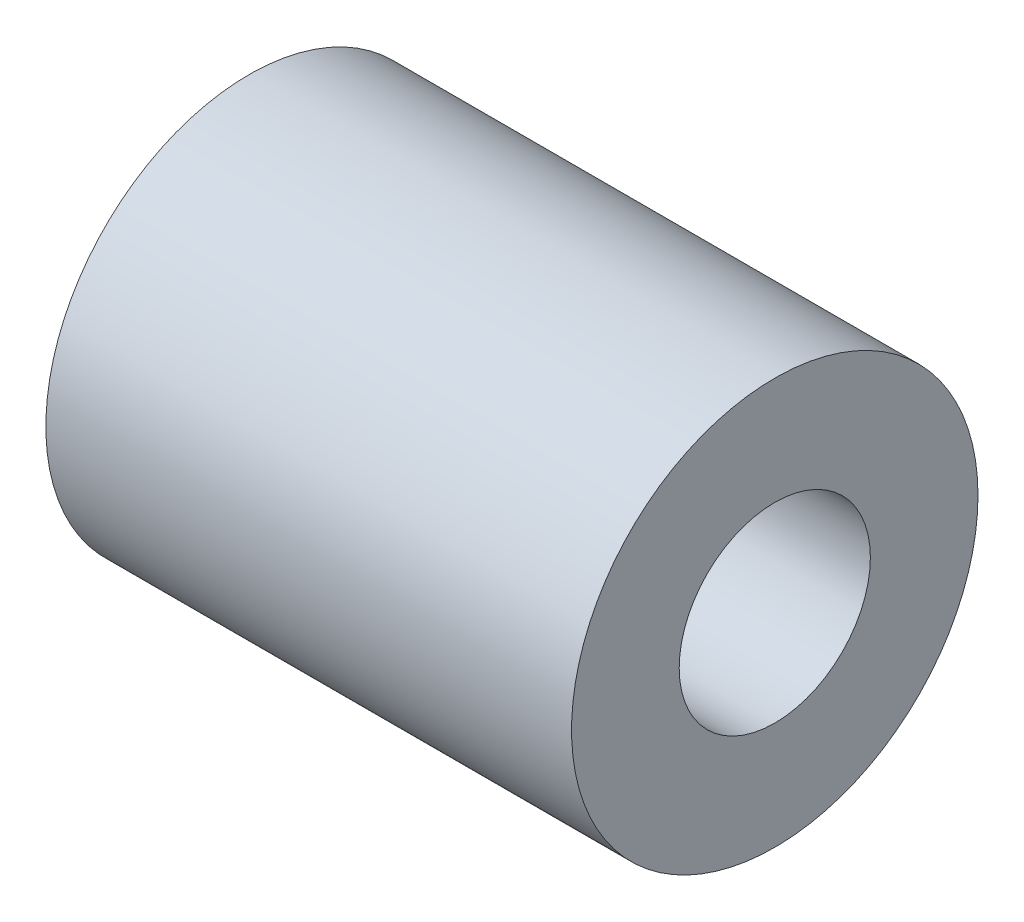
from build123d import *

# Parameters (mm, degrees)
ESBO_O1_W = 34.925
ESBO_O1_H = 7.1501


with BuildPart() as part:
    # Esboço1 → Revolução1 (revolve)
    with BuildSketch(Plane.XY, mode=Mode.PRIVATE) as revolu_o1_sk:
        with Locations((0, 9.92505)):
            Rectangle(ESBO_O1_W, ESBO_O1_H)
    revolve(revolu_o1_sk.sketch.rotate(Axis((-17.4625, 0, 0), (1, 0, 0)), 270), axis=Axis((-17.4625, 0, 0), (1, 0, 0)))


solid = part.part
